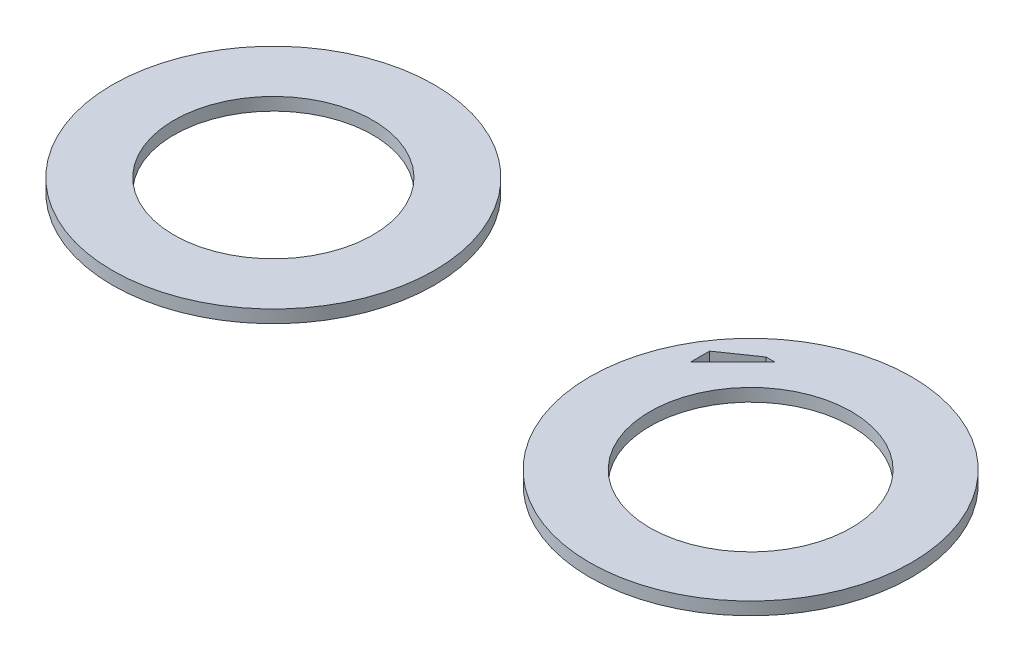
from build123d import *

# Parameters (mm, degrees)
SKETCH1_R           = 31.55
SKETCH1_R_2         = 19.5
BOSS_EXTRUDE1_DEPTH = 2.5
SKETCH2_R           = 31.55
SKETCH2_R_2         = 19.75
BOSS_EXTRUDE2_DEPTH = 2.5


with BuildPart() as part:
    # Sketch1 → Boss-Extrude1 (new body)
    with BuildSketch(Plane(origin=(0, 0, 0), x_dir=(1, 0, 0), z_dir=(0, 1, 0))):
        with Locations(Location((-43.991519585, 12.09868885, 0), (0, 0, 270))):
            Circle(SKETCH1_R)
        with Locations(Location((-43.991519585, 12.09868885, 0), (0, 0, 270))):
            Circle(SKETCH1_R_2, mode=Mode.SUBTRACT)
    extrude(amount=BOSS_EXTRUDE1_DEPTH)


with BuildPart() as body_2:
    # Sketch2 → Boss-Extrude2 (new body)
    with BuildSketch(Plane(origin=(0, 0, 0), x_dir=(1, 0, 0), z_dir=(0, 1, 0))):
        with Locations(Location((52.376774814, 9.296666524, 0), (0, 0, 270))):
            Circle(SKETCH2_R)
        with Locations(Location((52.376774814, 9.296666524, 0), (0, 0, 270))):
            Circle(SKETCH2_R_2, mode=Mode.SUBTRACT)
        Polygon((28.215429536, 25.404230043), (28.215429536, 21.629019843), (36.520891975, 29.934482282), (34.759127216, 29.934482282), align=None, mode=Mode.SUBTRACT)
    extrude(amount=BOSS_EXTRUDE2_DEPTH)


solid = Compound([part.part, body_2.part])
